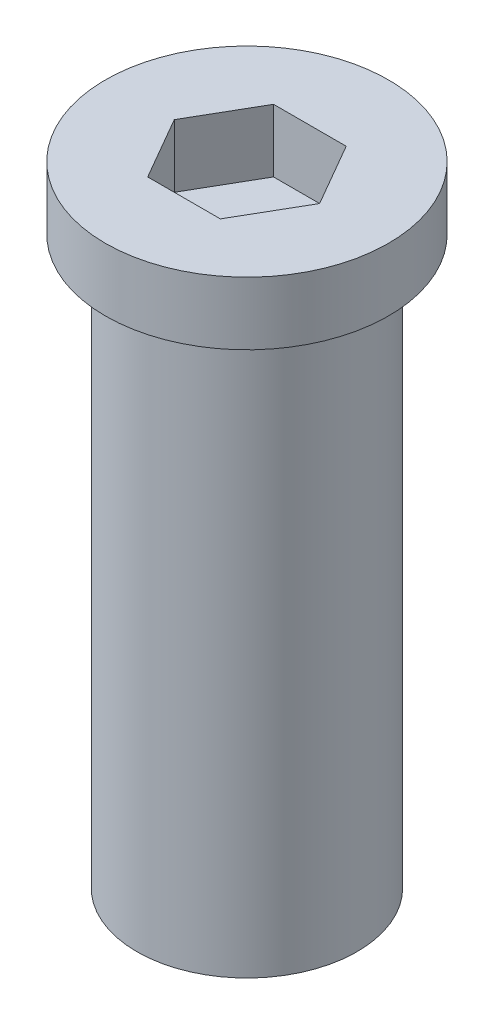
from build123d import *

# Parameters (mm, degrees)
SKETCH1_R           = 1.75
BOSS_EXTRUDE1_DEPTH = 4.5
SKETCH2_R           = 2.25
BOSS_EXTRUDE2_DEPTH = 1
CUT_EXTRUDE1_DEPTH  = 1


with BuildPart() as part:
    # Sketch1 → Boss-Extrude1 (new, symmetric)
    with BuildSketch(Plane(origin=(0, 0, 0), x_dir=(1, 0, 0), z_dir=(0, 1, 0))):
        with Locations(Location((0, 0, 0), (0, 0, 270))):
            Circle(SKETCH1_R)
    extrude(amount=BOSS_EXTRUDE1_DEPTH, both=True)

    # Sketch2 → Boss-Extrude2 (add)
    with BuildSketch(Plane(origin=(0, 4.5, 0), x_dir=(1, 0, 0), z_dir=(0, 1, 0))):
        with Locations(Location((0, 0, 0), (0, 0, 270))):
            Circle(SKETCH2_R)
    extrude(amount=BOSS_EXTRUDE2_DEPTH)

    # Sketch3 → Cut-Extrude1 (cut)
    with BuildSketch(Plane(origin=(0, 5.5, 0), x_dir=(1, 0, 0), z_dir=(0, 1, 0))):
        Polygon((1.154700538, 0), (0.577350269, 1), (-0.577350269, 1), (-1.154700538, 0), (-0.577350269, -1), (0.577350269, -1), align=None)
    extrude(amount=-CUT_EXTRUDE1_DEPTH, mode=Mode.SUBTRACT)


solid = part.part
